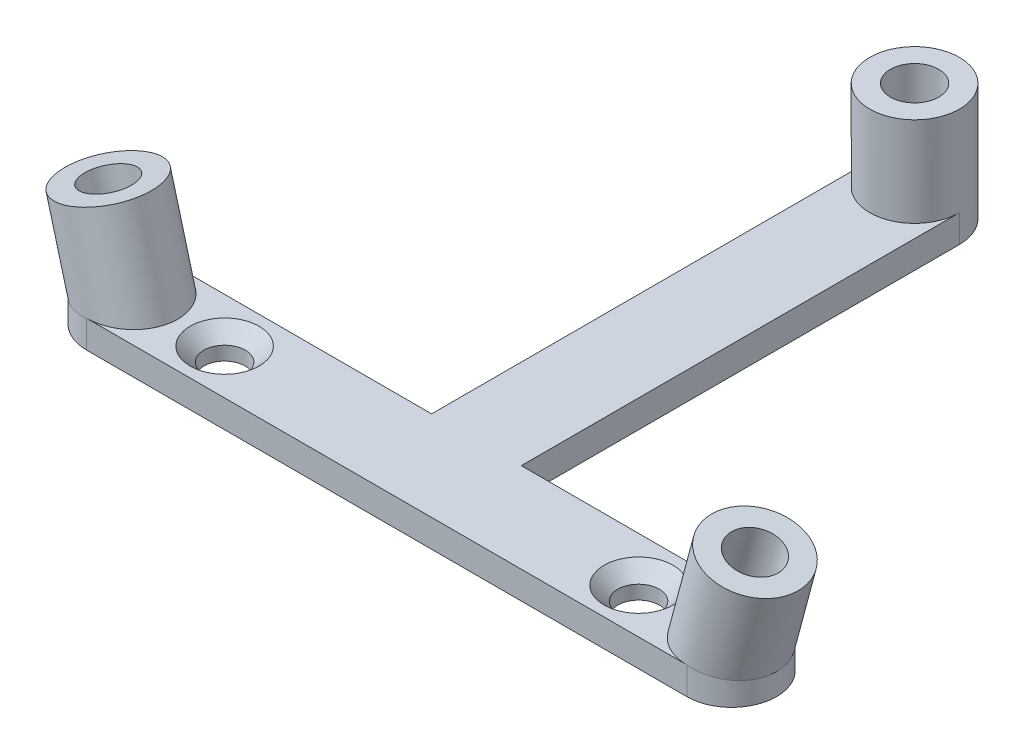
from build123d import *

# Parameters (mm, degrees)
BOSS_EXTRUDE1_DEPTH = 2
BOSS_EXTRUDE4_DEPTH = 2
SKETCH6_R           = 3.25
SKETCH6_R_2         = 1.75
BOSS_EXTRUDE5_DEPTH = 6.5
BOSS_EXTRUDE2_START = -0.870835
SKETCH2_R           = 3.25
SKETCH2_R_2         = 1.75
BOSS_EXTRUDE2_DEPTH = 7.370835
BOSS_EXTRUDE3_START = -0.870835
SKETCH3_R           = 3.25
SKETCH3_R_2         = 1.75
BOSS_EXTRUDE3_DEPTH = 7.370835
SKETCH4_R           = 1.5
CUT_EXTRUDE1_DEPTH  = 2
CHAMFER1_SIZE       = 1


with BuildPart() as part:
    # Sketch1 → Boss-Extrude1 (new body)
    with BuildSketch(Plane(origin=(0, 0, 0), x_dir=(1, 0, 0), z_dir=(0, 1, 0))):
        with BuildLine():
            Line((-21.75, 3.25), (21.75, 3.25))
            ThreePointArc((21.75, 3.25), (25, 0), (21.75, -3.25))
            Line((21.75, -3.25), (-21.75, -3.25))
            ThreePointArc((-21.75, -3.25), (-25, 0), (-21.75, 3.25))
        make_face()
    extrude(amount=BOSS_EXTRUDE1_DEPTH)

    # Sketch5 → Boss-Extrude4 (add)
    with BuildSketch(Plane(origin=(0, 0, 0), x_dir=(1, 0, 0), z_dir=(0, 1, 0))):
        with BuildLine():
            Line((-3.25, 0), (3.25, 0))
            Line((3.25, 0), (3.25, 35))
            ThreePointArc((3.25, 35), (0, 38.25), (-3.25, 35))
            Line((-3.25, 35), (-3.25, 0))
        make_face()
    extrude(amount=BOSS_EXTRUDE4_DEPTH)

    # Sketch6 → Boss-Extrude5 (add)
    with BuildSketch(Plane(origin=(0, 2, 0), x_dir=(1, 0, 0), z_dir=(0, 1, 0))):
        with Locations(Location((0, 35, 0), (0, 0, 180))):
            Circle(SKETCH6_R)
        with Locations((0, 35)):
            Circle(SKETCH6_R_2, mode=Mode.SUBTRACT)
    extrude(amount=BOSS_EXTRUDE5_DEPTH)

    # Sketch2 → Boss-Extrude2 (add)
    with BuildSketch(Plane(origin=(-1.956973734, 7.303525404, 0), x_dir=(0, 0, -1), z_dir=(-0.25881904510252135, 0.9659258262890681, 0)).offset(BOSS_EXTRUDE2_START)):
        with Locations((0, 20.491248632)):
            Circle(SKETCH2_R)
        with Locations(Location((0, 20.491248632, 0), (0, 0, 270))):
            Circle(SKETCH2_R_2, mode=Mode.SUBTRACT)
    extrude(amount=BOSS_EXTRUDE2_DEPTH)

    # Sketch3 → Boss-Extrude3 (add)
    with BuildSketch(Plane(origin=(1.956973734, 7.303525404, 0), x_dir=(0, 0, -1), z_dir=(0.25881904510252135, 0.9659258262890681, 0)).offset(BOSS_EXTRUDE3_START)):
        with Locations((0, -20.491248632)):
            Circle(SKETCH3_R)
        with Locations(Location((0, -20.491248632, 0), (0, 0, 90))):
            Circle(SKETCH3_R_2, mode=Mode.SUBTRACT)
    extrude(amount=BOSS_EXTRUDE3_DEPTH)

    # Sketch4 → Cut-Extrude1 (cut)
    with BuildSketch(Plane(origin=(0, 2, 0), x_dir=(1, 0, 0), z_dir=(0, 1, 0))):
        with Locations(Location((-15, 0, 0), (0, 0, 270))):
            Circle(SKETCH4_R)
        with Locations(Location((15, 0, 0), (0, 0, 270))):
            Circle(SKETCH4_R)
    extrude(amount=-CUT_EXTRUDE1_DEPTH, mode=Mode.SUBTRACT)

    # Chamfer1
    chamfer1_edges = [part.edges().sort_by_distance(p)[0] for p in [
        (-15, 2, -1.5),
        (15, 2, -1.5),
    ]]
    chamfer(chamfer1_edges, length=CHAMFER1_SIZE)


solid = part.part
